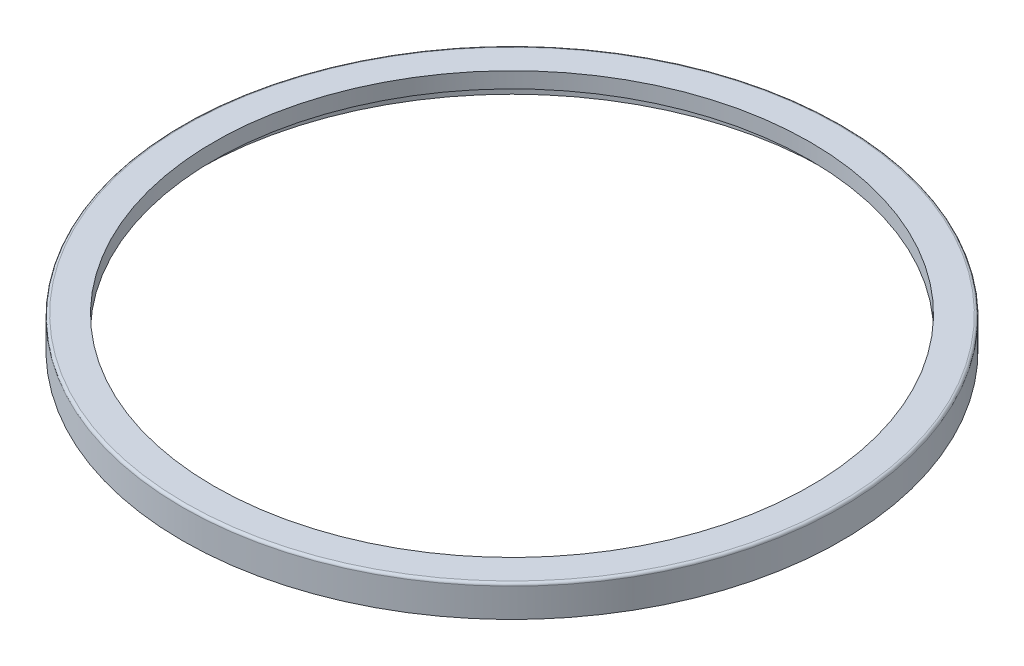
from build123d import *

# Parameters (mm, degrees)
FILLET1_R = 1.5875
FILLET2_R = 0.508


with BuildPart() as part:
    # Sketch1 → Revolve1 (revolve)
    with BuildSketch(Plane.XY, mode=Mode.PRIVATE) as revolve1_sk:
        Polygon((-57.7215, 0), (-63.8175, 0), (-63.8175, -6.096), (-60.7695, -6.096), (-60.7695, -3.048), (-57.7215, -3.048), align=None)
    revolve(revolve1_sk.sketch.rotate(Axis((0, 0, 0), (0, 1, 0)), 270), axis=Axis((0, 0, 0), (0, 1, 0)))

    # Fillet1
    fillet1_edges = [part.edges().sort_by_distance(p)[0] for p in [
        (0, -3.048, 60.7695),
    ]]
    fillet(fillet1_edges, radius=FILLET1_R)

    # Fillet2
    fillet2_edges = [part.edges().sort_by_distance(p)[0] for p in [
        (0, 0, 63.8175),
    ]]
    fillet(fillet2_edges, radius=FILLET2_R)


solid = part.part
